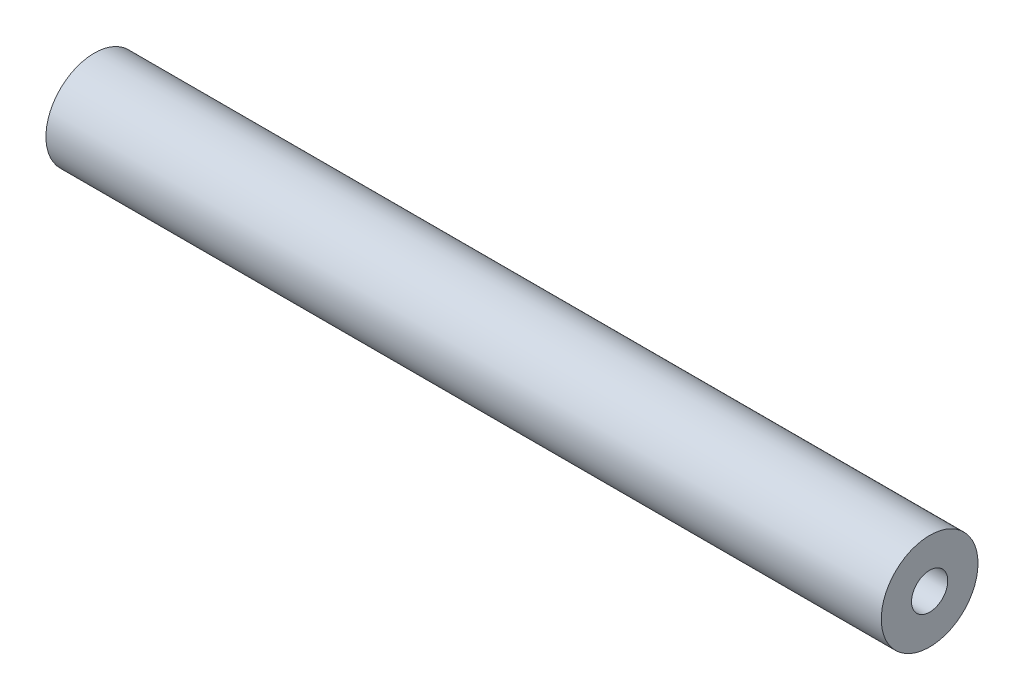
from build123d import *

# Parameters (mm, degrees)
SKETCH1_R           = 4
BOSS_EXTRUDE1_DEPTH = 69.09
SKETCH2_R           = 1.5
CUT_EXTRUDE1_DEPTH  = 70.321195171


with BuildPart() as part:
    # Sketch1 → Boss-Extrude1 (new body)
    with BuildSketch(Plane(origin=(0, 0, 0), x_dir=(0, 0, -1), z_dir=(1, 0, 0))):
        Circle(SKETCH1_R)
    extrude(amount=BOSS_EXTRUDE1_DEPTH)

    # Sketch2 → Cut-Extrude1 (cut, through all)
    with BuildSketch(Plane.ZY):
        Circle(SKETCH2_R)
    extrude(amount=-CUT_EXTRUDE1_DEPTH, mode=Mode.SUBTRACT)


solid = part.part
